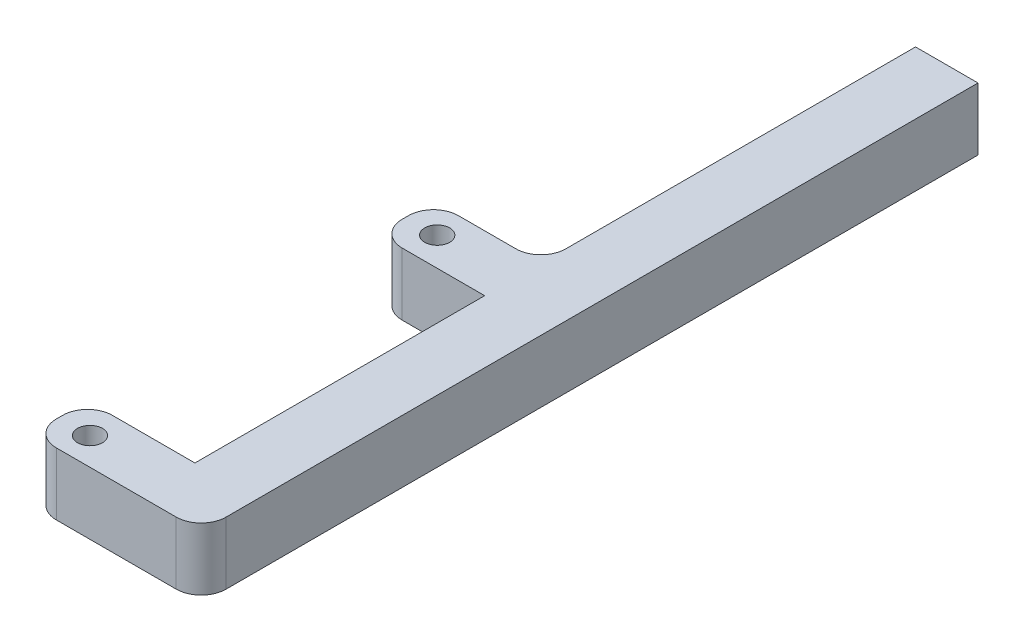
from build123d import *

# Parameters (mm, degrees)
SKETCH1_R           = 1
BOSS_EXTRUDE1_DEPTH = 5
FILLET1_R           = 2


with BuildPart() as part:
    # Sketch1 → Boss-Extrude1 (new body)
    with BuildSketch(Plane(origin=(0, 0, 0), x_dir=(1, 0, 0), z_dir=(0, 1, 0))):
        Polygon((0, 4.5), (8.6, 4.5), (8.6, 27.7), (0, 27.7), (0, 32.2), (8.6, 32.2), (8.6, 62.2), (13.6, 62.2), (13.6, 0), (0, 0), align=None)
        with Locations(Location((2.5, 2.2, 0), (0, 0, 270))):
            Circle(SKETCH1_R, mode=Mode.SUBTRACT)
        with Locations(Location((2.5, 30, 0), (0, 0, 270))):
            Circle(SKETCH1_R, mode=Mode.SUBTRACT)
    extrude(amount=BOSS_EXTRUDE1_DEPTH)

    # Fillet1
    fillet1_edges = [part.edges().sort_by_distance(p)[0] for p in [
        (0, 2.5, -4.5),
        (0, 2.5, -27.7),
        (0, 2.5, -32.2),
        (8.6, 2.5, -32.2),
        (13.6, 2.5, 0),
        (0, 2.5, 0),
    ]]
    fillet(fillet1_edges, radius=FILLET1_R)


solid = part.part
